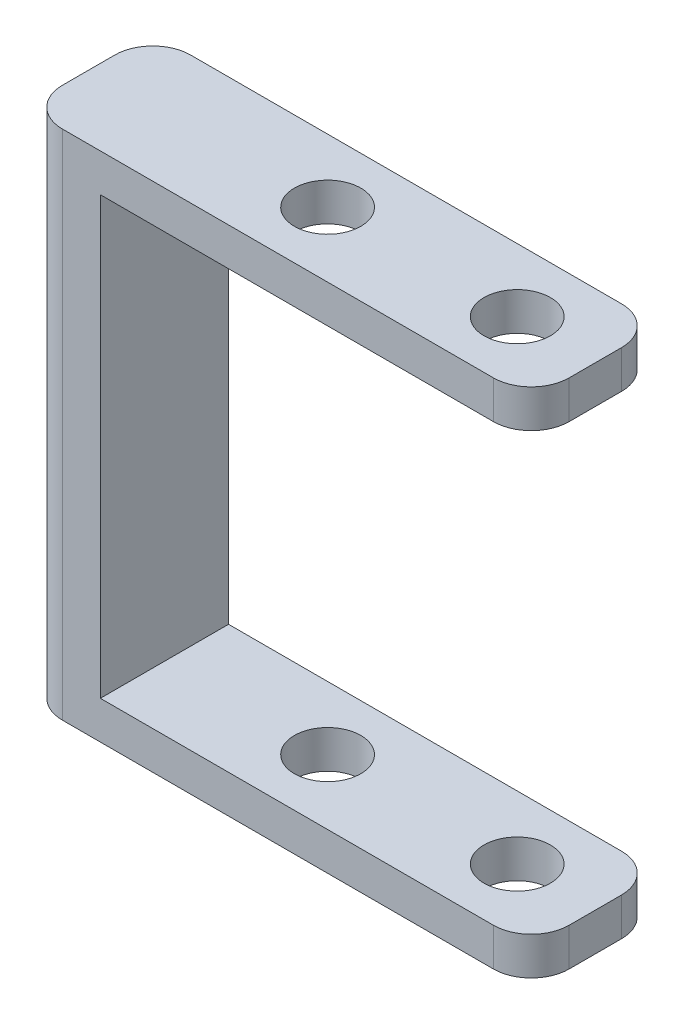
from build123d import *

# Parameters (mm, degrees)
SKETCH_1_R               = 1.75
EXTRUDE_1_DEPTH          = 27
CUT_EXTRUDE_1_DEPTH      = 33.108140695
CUT_EXTRUDE_1_DEPTH_BACK = 33.108140695
SKETCH_2_W               = 29.052061839
SKETCH_2_H               = 23


with BuildPart() as part:
    # 草图1 → 凸台-拉伸1 (new body)
    with BuildSketch(Plane(origin=(0, 0, 0), x_dir=(1, 0, 0), z_dir=(0, 1, 0))):
        with BuildLine():
            Line((-14.006965108, 3.648412425), (8.718499779, 3.648412425))
            ThreePointArc((8.718499779, 3.648412425), (10.132713341, 3.062625987), (10.718499779, 1.648412425))
            Line((10.718499779, 1.648412425), (10.718499779, -1.112487436))
            ThreePointArc((10.718499779, -1.112487436), (10.132713341, -2.526700998), (8.718499779, -3.112487436))
            Line((8.718499779, -3.112487436), (-14.006965108, -3.112487436))
            ThreePointArc((-14.006965108, -3.112487436), (-15.421178671, -2.526700998), (-16.006965108, -1.112487436))
            Line((-16.006965108, -1.112487436), (-16.006965108, 1.648412425))
            ThreePointArc((-16.006965108, 1.648412425), (-15.421178671, 3.062625987), (-14.006965108, 3.648412425))
        make_face()
        with Locations(Location((-3.445225135, 0.309187494, 0), (0, 0, 270))):
            Circle(SKETCH_1_R, mode=Mode.SUBTRACT)
        with Locations(Location((6.554774865, 0.309187494, 0), (0, 0, 270))):
            Circle(SKETCH_1_R, mode=Mode.SUBTRACT)
    extrude(amount=EXTRUDE_1_DEPTH)

    # 草图2 → 切除-拉伸1 (cut, two sides: drawn at the far end of the back side and taken through both)
    with BuildSketch(Plane.XY.offset(3.112487436).offset(-CUT_EXTRUDE_1_DEPTH_BACK)):
        with Locations((2.519065811, 13.5)):
            Rectangle(SKETCH_2_W, SKETCH_2_H)
    extrude(amount=CUT_EXTRUDE_1_DEPTH + CUT_EXTRUDE_1_DEPTH_BACK, mode=Mode.SUBTRACT)


solid = part.part
